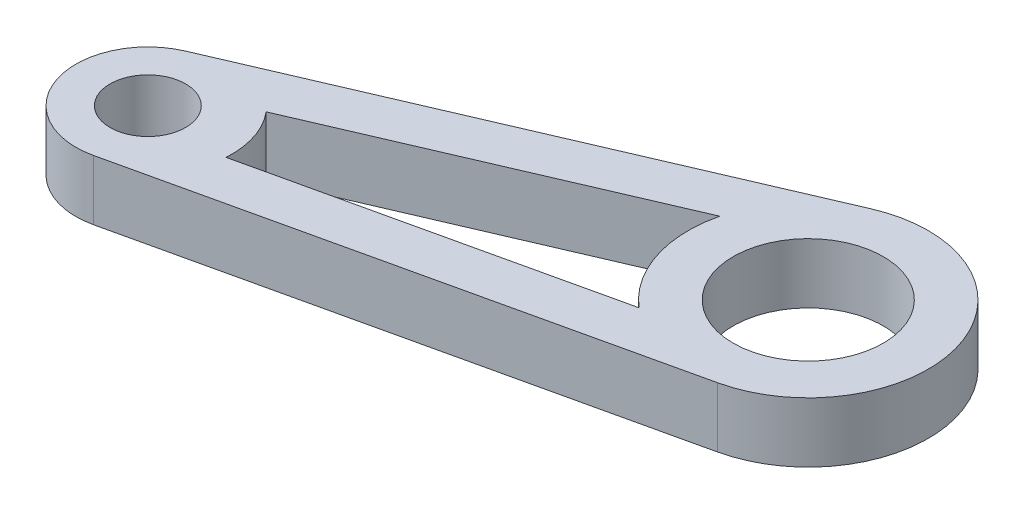
from build123d import *

# Parameters (mm, degrees)
SKETCH1_R           = 3.96875
SKETCH1_R_2         = 2
BOSS_EXTRUDE1_DEPTH = 3.175


with BuildPart() as part:
    # Sketch1 → Boss-Extrude1 (new body)
    with BuildSketch(Plane(origin=(0, 0, 0), x_dir=(1, 0, 0), z_dir=(0, 1, 0))):
        with BuildLine():
            Line((1.402094694, -6.193273001), (-25.521322666, -12.288463801))
            ThreePointArc((-25.521322666, -12.288463801), (-29.985830904, -9.750697408), (-27.867805259, -5.07244352))
            Line((-27.867805259, -5.07244352), (-2.508709628, 5.833427466))
            ThreePointArc((-2.508709628, 5.833427466), (6.03875237, 1.963662347), (1.402094694, -6.193273001))
        make_face()
        with Locations(Location((0, 0, 0), (0, 0, 270))):
            Circle(SKETCH1_R, mode=Mode.SUBTRACT)
        with Locations(Location((-26.362579482, -8.5725, 0), (0, 0, 270))):
            Circle(SKETCH1_R_2, mode=Mode.SUBTRACT)
        with BuildLine():
            Line((-4.113361585, -4.837639556), (-21.927586713, -8.870600886))
            ThreePointArc((-21.927586713, -8.870600886), (-22.135452823, -7.197936357), (-22.951139301, -5.722920928))
            Line((-22.951139301, -5.722920928), (-6.17196775, 1.493088778))
            ThreePointArc((-6.17196775, 1.493088778), (-6.03875237, -1.963662347), (-4.113361585, -4.837639556))
        make_face(mode=Mode.SUBTRACT)
    extrude(amount=-BOSS_EXTRUDE1_DEPTH)


solid = part.part
